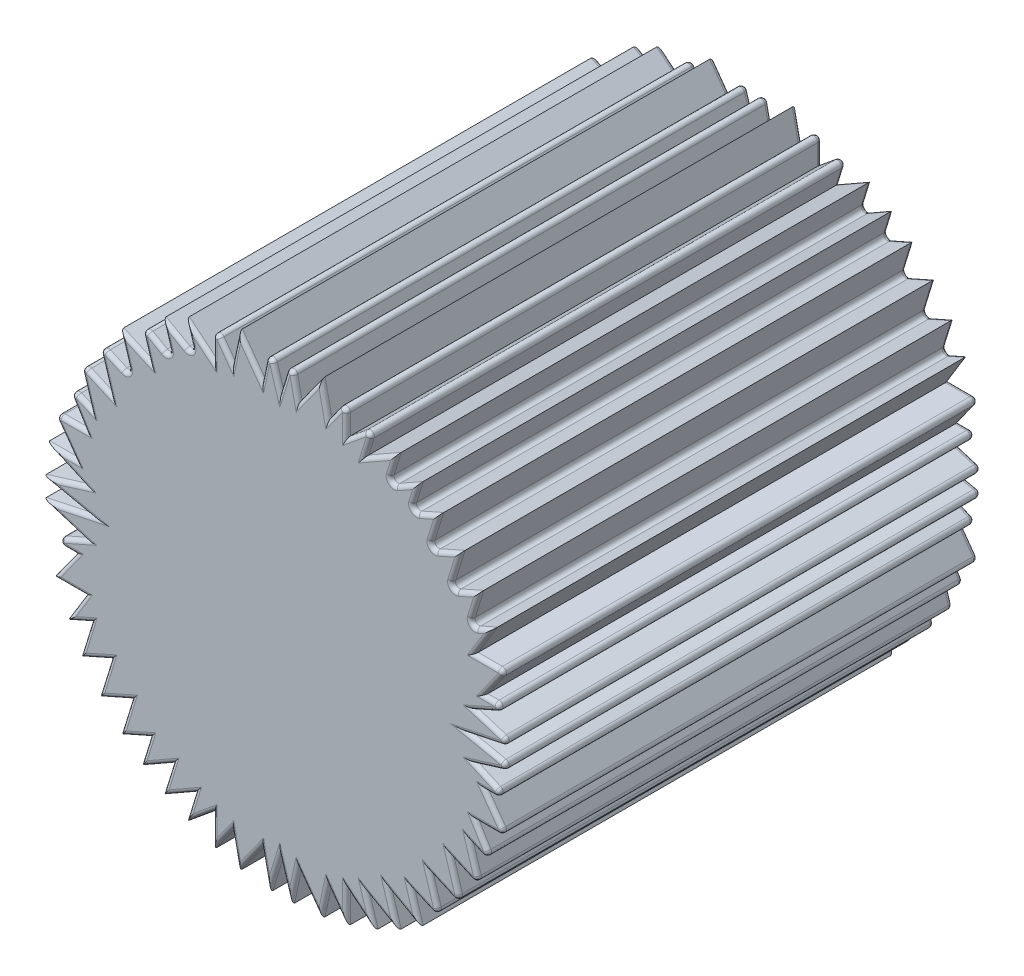
from build123d import *

# Parameters (mm, degrees)
BOSS_EXTRUDE1_DEPTH = 6
FILLET2_R           = 0.05
SKETCH2_R           = 1
CUT_EXTRUDE1_DEPTH  = 2


with BuildPart() as part:
    # Sketch1 → Boss-Extrude1 (new body)
    with BuildSketch(Plane.XY):
        Polygon((0, 2.550899699), (0.13737463, 2.996853051), (0.23136791, 2.550899699), (0.522136974, 2.954212751), (0.607142987, 2.550899699), (0.843640877, 2.878935579), (0.843640877, 2.466482074), (1.191458704, 2.753257372), (1.074338787, 2.373056026), (1.484190702, 2.607139804), (1.357878782, 2.197098851), (1.762097029, 2.427965004), (1.646030212, 2.051182287), (2.020675518, 2.217401734), (1.878298473, 1.75520926), (2.290089182, 1.937909063), (2.138627852, 1.446226665), (2.526169571, 1.618167883), (2.386576493, 1.165012878), (2.701433409, 1.30470592), (2.456373032, 0.904968077), (2.860250475, 0.904968077), (2.578903221, 0.514723604), (2.955513426, 0.514723604), (2.456373032, 0.293269235), (2.997326275, 0.126630165), (2.396526446, 0), (2.997326275, -0.126630165), (2.456373032, -0.293269235), (2.955513426, -0.514723604), (2.578903221, -0.514723604), (2.860250475, -0.904968077), (2.456373032, -0.904968077), (2.701433409, -1.30470592), (2.386576493, -1.165012878), (2.526169571, -1.618167883), (2.138627852, -1.446226665), (2.290089182, -1.937909063), (1.878298473, -1.75520926), (2.020675518, -2.217401734), (1.646030212, -2.051182287), (1.762097029, -2.427965004), (1.357878782, -2.197098851), (1.484190702, -2.607139804), (1.074338787, -2.373056026), (1.191458704, -2.753257372), (0.843640877, -2.466482074), (0.843640877, -2.878935579), (0.607142987, -2.550899699), (0.522136974, -2.954212751), (0.23136791, -2.550899699), (0.13737463, -2.996853051), (0, -2.550899699), (-0.13737463, -2.996853051), (-0.23136791, -2.550899699), (-0.522136974, -2.954212751), (-0.607142987, -2.550899699), (-0.843640877, -2.878935579), (-0.843640877, -2.466482074), (-1.191458704, -2.753257372), (-1.074338787, -2.373056026), (-1.484190702, -2.607139804), (-1.357878782, -2.197098851), (-1.762097029, -2.427965004), (-1.646030212, -2.051182287), (-2.020675518, -2.217401734), (-1.878298473, -1.75520926), (-2.290089182, -1.937909063), (-2.138627852, -1.446226665), (-2.526169571, -1.618167883), (-2.386576493, -1.165012878), (-2.701433409, -1.30470592), (-2.456373032, -0.904968077), (-2.860250475, -0.904968077), (-2.578903221, -0.514723604), (-2.955513426, -0.514723604), (-2.456373032, -0.293269235), (-2.997326275, -0.126630165), (-2.396526446, 0), (-2.997326275, 0.126630165), (-2.456373032, 0.293269235), (-2.955513426, 0.514723604), (-2.578903221, 0.514723604), (-2.860250475, 0.904968077), (-2.456373032, 0.904968077), (-2.701433409, 1.30470592), (-2.386576493, 1.165012878), (-2.526169571, 1.618167883), (-2.138627852, 1.446226665), (-2.290089182, 1.937909063), (-1.878298473, 1.75520926), (-2.020675518, 2.217401734), (-1.646030212, 2.051182287), (-1.762097029, 2.427965004), (-1.357878782, 2.197098851), (-1.484190702, 2.607139804), (-1.074338787, 2.373056026), (-1.191458704, 2.753257372), (-0.843640877, 2.466482074), (-0.843640877, 2.878935579), (-0.607142987, 2.550899699), (-0.522136974, 2.954212751), (-0.23136791, 2.550899699), (-0.13737463, 2.996853051), align=None)
    extrude(amount=BOSS_EXTRUDE1_DEPTH)

    # Fillet2
    fillet2_edges = [part.edges().sort_by_distance(p)[0] for p in [
        (-2.544004951, 1.234859399, 6),
        (0.18437127, 2.773876375, 0),
        (-2.578903221, 1.104836998, 6),
        (0.376752442, 2.752556225, 0),
        (0.564639981, 2.752556225, 0),
        (0.725391932, 2.714917639, 0),
        (0.843640877, 2.672708826, 0),
        (1.01754979, 2.609869723, 0),
        (1.132898745, 2.563156699, 0),
        (1.279264745, 2.490097915, 0),
        (1.421034742, 2.402119328, 0),
        (-0.068687315, 2.773876375, 6),
        (1.559987906, 2.312531927, 0),
        (1.70406362, 2.239573645, 0),
        (-2.658311754, 0.904968077, 6),
        (1.833352865, 2.134292011, 0),
        (1.949486996, 1.986305497, 0),
        (2.084193828, 1.846559162, 0),
        (2.214358517, 1.692067864, 0),
        (2.332398712, 1.532197274, 0),
        (2.456373032, 1.39159038, 0),
        (2.544004951, 1.234859399, 0),
        (2.578903221, 1.104836998, 0),
        (2.658311754, 0.904968077, 0),
        (2.719576848, 0.709845841, 0),
        (-2.719576848, 0.709845841, 6),
        (2.767208323, 0.514723604, 0),
        (2.705943229, 0.40399642, 0),
        (2.726849654, 0.2099497, 0),
        (2.696926361, 0.063315082, 0),
        (2.696926361, -0.063315082, 0),
        (2.726849654, -0.2099497, 0),
        (2.705943229, -0.40399642, 0),
        (2.767208323, -0.514723604, 0),
        (2.719576848, -0.709845841, 0),
        (2.658311754, -0.904968077, 0),
        (-2.767208323, 0.514723604, 6),
        (2.578903221, -1.104836998, 0),
        (2.544004951, -1.234859399, 0),
        (2.456373032, -1.39159038, 0),
        (2.332398712, -1.532197274, 0),
        (2.214358517, -1.692067864, 0),
        (2.084193828, -1.846559162, 0),
        (1.949486996, -1.986305497, 0),
        (1.833352865, -2.134292011, 0),
        (1.70406362, -2.239573645, 0),
        (1.559987906, -2.312531927, 0),
        (-2.705943229, 0.40399642, 6),
        (1.421034742, -2.402119328, 0),
        (1.279264745, -2.490097915, 0),
        (1.132898745, -2.563156699, 0),
        (1.01754979, -2.609869723, 0),
        (0.843640877, -2.672708826, 0),
        (0.725391932, -2.714917639, 0),
        (0.564639981, -2.752556225, 0),
        (0.376752442, -2.752556225, 0),
        (0.18437127, -2.773876375, 0),
        (0.068687315, -2.773876375, 0),
        (-2.726849654, 0.2099497, 6),
        (-0.068687315, -2.773876375, 0),
        (-0.18437127, -2.773876375, 0),
        (-0.376752442, -2.752556225, 0),
        (-0.564639981, -2.752556225, 0),
        (-0.725391932, -2.714917639, 0),
        (-0.843640877, -2.672708826, 0),
        (-1.01754979, -2.609869723, 0),
        (-1.132898745, -2.563156699, 0),
        (-1.279264745, -2.490097915, 0),
        (-1.421034742, -2.402119328, 0),
        (-2.696926361, 0.063315082, 6),
        (-1.559987906, -2.312531927, 0),
        (-1.70406362, -2.239573645, 0),
        (-1.833352865, -2.134292011, 0),
        (-1.949486996, -1.986305497, 0),
        (-2.084193828, -1.846559162, 0),
        (-2.214358517, -1.692067864, 0),
        (-2.332398712, -1.532197274, 0),
        (-2.456373032, -1.39159038, 0),
        (-2.544004951, -1.234859399, 0),
        (-2.578903221, -1.104836998, 0),
        (-2.696926361, -0.063315082, 6),
        (-2.658311754, -0.904968077, 0),
        (-2.719576848, -0.709845841, 0),
        (-2.767208323, -0.514723604, 0),
        (-2.705943229, -0.40399642, 0),
        (-2.726849654, -0.2099497, 0),
        (-2.696926361, -0.063315082, 0),
        (-2.696926361, 0.063315082, 0),
        (-2.726849654, 0.2099497, 0),
        (-2.705943229, 0.40399642, 0),
        (-2.767208323, 0.514723604, 0),
        (-2.726849654, -0.2099497, 6),
        (-2.719576848, 0.709845841, 0),
        (-2.658311754, 0.904968077, 0),
        (-2.578903221, 1.104836998, 0),
        (-2.544004951, 1.234859399, 0),
        (-2.456373032, 1.39159038, 0),
        (-2.332398712, 1.532197274, 0),
        (-2.214358517, 1.692067864, 0),
        (-2.084193828, 1.846559162, 0),
        (-1.949486996, 1.986305497, 0),
        (-1.833352865, 2.134292011, 0),
        (-2.705943229, -0.40399642, 6),
        (-1.70406362, 2.239573645, 0),
        (-1.559987906, 2.312531927, 0),
        (-1.421034742, 2.402119328, 0),
        (-1.279264745, 2.490097915, 0),
        (-1.132898745, 2.563156699, 0),
        (-1.01754979, 2.609869723, 0),
        (-0.843640877, 2.672708826, 0),
        (-0.725391932, 2.714917639, 0),
        (-0.564639981, 2.752556225, 0),
        (-0.376752442, 2.752556225, 0),
        (-2.767208323, -0.514723604, 6),
        (-0.18437127, 2.773876375, 0),
        (-0.068687315, 2.773876375, 0),
        (0.068687315, 2.773876375, 0),
        (-0.18437127, 2.773876375, 6),
        (-2.719576848, -0.709845841, 6),
        (-2.658311754, -0.904968077, 6),
        (-2.578903221, -1.104836998, 6),
        (-2.544004951, -1.234859399, 6),
        (-2.456373032, -1.39159038, 6),
        (-2.332398712, -1.532197274, 6),
        (0.13737463, 2.996853051, 3),
        (0.843640877, 2.878935579, 3),
        (1.191458704, 2.753257372, 3),
        (1.357878782, 2.197098851, 3),
        (1.646030212, 2.051182287, 3),
        (1.878298473, 1.75520926, 3),
        (2.138627852, 1.446226665, 3),
        (2.386576493, 1.165012878, 3),
        (-2.214358517, -1.692067864, 6),
        (2.860250475, 0.904968077, 3),
        (2.955513426, 0.514723604, 3),
        (2.997326275, 0.126630165, 3),
        (2.997326275, -0.126630165, 3),
        (2.955513426, -0.514723604, 3),
        (2.860250475, -0.904968077, 3),
        (2.701433409, -1.30470592, 3),
        (2.526169571, -1.618167883, 3),
        (2.290089182, -1.937909063, 3),
        (2.020675518, -2.217401734, 3),
        (-2.084193828, -1.846559162, 6),
        (-2.955513426, -0.514723604, 3),
        (-2.860250475, 0.904968077, 3),
        (-2.701433409, 1.30470592, 3),
        (-2.526169571, 1.618167883, 3),
        (-2.290089182, 1.937909063, 3),
        (-1.878298473, 1.75520926, 3),
        (-1.762097029, 2.427965004, 3),
        (-1.357878782, 2.197098851, 3),
        (-1.074338787, 2.373056026, 3),
        (-0.843640877, 2.878935579, 3),
        (-0.13737463, 2.996853051, 3),
        (-1.949486996, -1.986305497, 6),
        (-1.833352865, -2.134292011, 6),
        (-0.376752442, 2.752556225, 6),
        (-1.70406362, -2.239573645, 6),
        (-1.559987906, -2.312531927, 6),
        (-1.421034742, -2.402119328, 6),
        (-1.279264745, -2.490097915, 6),
        (-1.132898745, -2.563156699, 6),
        (-1.01754979, -2.609869723, 6),
        (-0.843640877, -2.672708826, 6),
        (-0.725391932, -2.714917639, 6),
        (-0.564639981, -2.752556225, 6),
        (-0.376752442, -2.752556225, 6),
        (-0.564639981, 2.752556225, 6),
        (-0.18437127, -2.773876375, 6),
        (-0.068687315, -2.773876375, 6),
        (0.068687315, -2.773876375, 6),
        (0.18437127, -2.773876375, 6),
        (0.376752442, -2.752556225, 6),
        (0.564639981, -2.752556225, 6),
        (0.725391932, -2.714917639, 6),
        (0.843640877, -2.672708826, 6),
        (1.01754979, -2.609869723, 6),
        (1.132898745, -2.563156699, 6),
        (-0.725391932, 2.714917639, 6),
        (1.279264745, -2.490097915, 6),
        (1.421034742, -2.402119328, 6),
        (1.559987906, -2.312531927, 6),
        (1.70406362, -2.239573645, 6),
        (1.833352865, -2.134292011, 6),
        (1.949486996, -1.986305497, 6),
        (2.084193828, -1.846559162, 6),
        (2.214358517, -1.692067864, 6),
        (2.332398712, -1.532197274, 6),
        (2.456373032, -1.39159038, 6),
        (-0.843640877, 2.672708826, 6),
        (2.544004951, -1.234859399, 6),
        (2.578903221, -1.104836998, 6),
        (2.658311754, -0.904968077, 6),
        (2.719576848, -0.709845841, 6),
        (2.767208323, -0.514723604, 6),
        (2.705943229, -0.40399642, 6),
        (2.726849654, -0.2099497, 6),
        (2.696926361, -0.063315082, 6),
        (2.696926361, 0.063315082, 6),
        (2.726849654, 0.2099497, 6),
        (-1.01754979, 2.609869723, 6),
        (2.705943229, 0.40399642, 6),
        (2.767208323, 0.514723604, 6),
        (2.719576848, 0.709845841, 6),
        (2.658311754, 0.904968077, 6),
        (2.578903221, 1.104836998, 6),
        (2.544004951, 1.234859399, 6),
        (2.456373032, 1.39159038, 6),
        (2.332398712, 1.532197274, 6),
        (2.214358517, 1.692067864, 6),
        (2.084193828, 1.846559162, 6),
        (-1.132898745, 2.563156699, 6),
        (1.949486996, 1.986305497, 6),
        (1.833352865, 2.134292011, 6),
        (1.70406362, 2.239573645, 6),
        (1.559987906, 2.312531927, 6),
        (1.421034742, 2.402119328, 6),
        (1.279264745, 2.490097915, 6),
        (1.132898745, 2.563156699, 6),
        (1.01754979, 2.609869723, 6),
        (0.843640877, 2.672708826, 6),
        (0.725391932, 2.714917639, 6),
        (-1.279264745, 2.490097915, 6),
        (0.564639981, 2.752556225, 6),
        (0.376752442, 2.752556225, 6),
        (0.18437127, 2.773876375, 6),
        (-1.421034742, 2.402119328, 6),
        (0.068687315, 2.773876375, 6),
        (-1.559987906, 2.312531927, 6),
        (-1.70406362, 2.239573645, 6),
        (-1.833352865, 2.134292011, 6),
        (-1.949486996, 1.986305497, 6),
        (-2.084193828, 1.846559162, 6),
        (-2.214358517, 1.692067864, 6),
        (-2.332398712, 1.532197274, 6),
        (-2.456373032, 1.39159038, 6),
    ]]
    fillet(fillet2_edges, radius=FILLET2_R)

    # Sketch2 → Cut-Extrude1 (cut)
    with BuildSketch(Plane(origin=(0, 0, 0), x_dir=(-1, 0, 0), z_dir=(0, 0, -1))):
        Circle(SKETCH2_R)
    extrude(amount=-CUT_EXTRUDE1_DEPTH, mode=Mode.SUBTRACT)


solid = part.part
